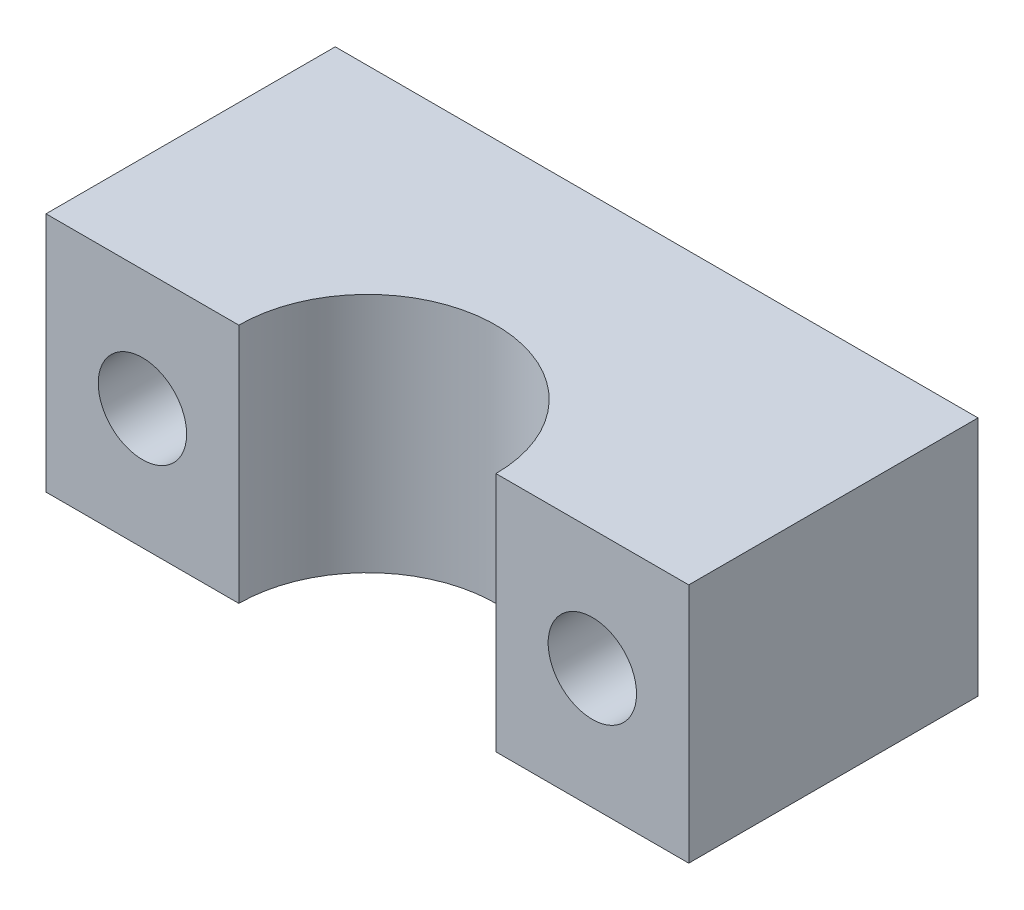
from build123d import *

# Parameters (mm, degrees)
SKETCH_1_W          = 40
SKETCH_1_H          = 15
EXTRUDE_1_DEPTH     = 18
SKETCH_2_R          = 8
CUT_EXTRUDE_1_DEPTH = 15
SKETCH_4_R          = 2.75
CUT_EXTRUDE_2_DEPTH = 47.357307946


with BuildPart() as part:
    # 草图1 → 凸台-拉伸1 (new body)
    with BuildSketch(Plane.XY):
        with Locations((20, -7.5)):
            Rectangle(SKETCH_1_W, SKETCH_1_H)
    extrude(amount=EXTRUDE_1_DEPTH)

    # 草图2 → 切除-拉伸1 (cut)
    with BuildSketch(Plane(origin=(0, 0, 0), x_dir=(1, 0, 0), z_dir=(0, 1, 0))):
        with Locations((20, -18)):
            Circle(SKETCH_2_R)
    extrude(amount=-CUT_EXTRUDE_1_DEPTH, mode=Mode.SUBTRACT)

    # 草图4 → 切除-拉伸2 (cut, through all)
    with BuildSketch(Plane.XY.offset(18)):
        with Locations((34, -7.5)):
            Circle(SKETCH_4_R)
        with Locations((6, -7.5)):
            Circle(SKETCH_4_R)
    extrude(amount=-CUT_EXTRUDE_2_DEPTH, mode=Mode.SUBTRACT)


solid = part.part
